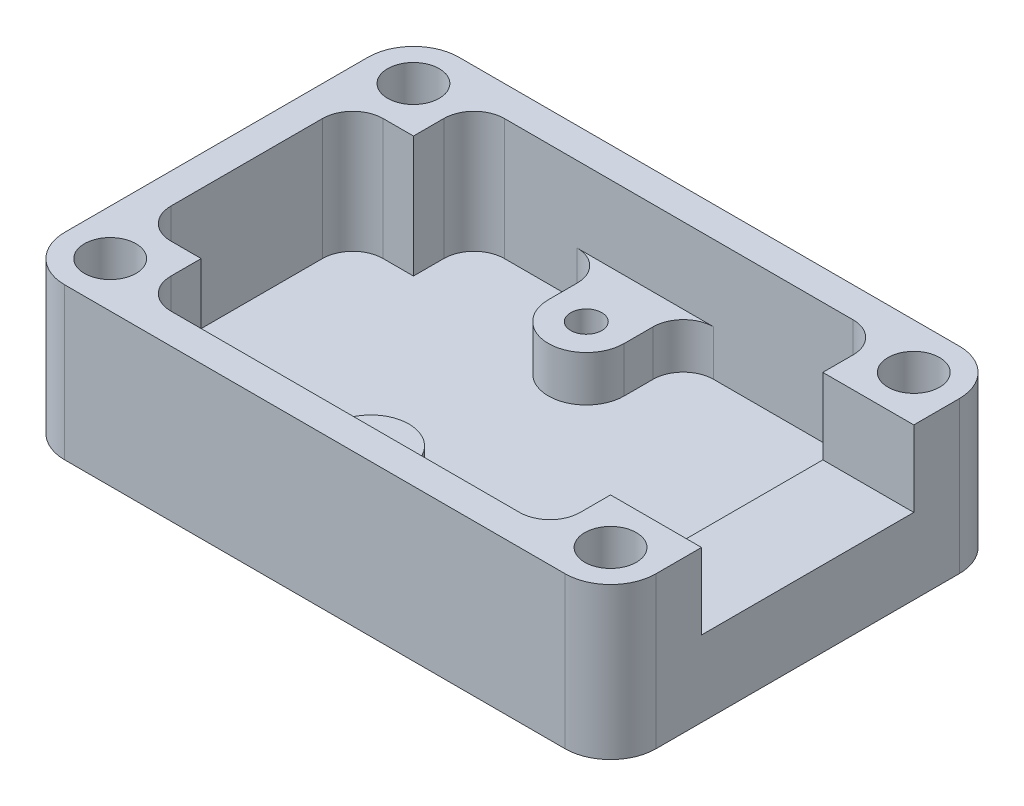
from build123d import *

# Parameters (mm, degrees)
SKETCH_1_W          = 39
SKETCH_1_H          = 26
EXTRUDE_1_DEPTH     = 10
SKETCH_2_W          = 35
SKETCH_2_H          = 22
CUT_EXTRUDE_1_DEPTH = 8
EXTRUDE_2_DEPTH     = 3
M2_5X0_451_D        = 2.05
M2_5X0_451_DEPTH    = 4
M2_5X0_451_TIP      = 0.615882135
SKETCH_6_W          = 6
SKETCH_6_H          = 6
EXTRUDE_3_DEPTH     = 8
HOLE_WIZARD_M32_D   = 3.4
CUT_EXTRUDE_2_REACH = 49.927
SKETCH_14_W         = 14
SKETCH_14_H         = 5
SKETCH_15_W         = 14
SKETCH_15_H         = 3
EXTRUDE_4_DEPTH     = 4
FILLET_1_R          = 2
FILLET_2_R          = 3


with BuildPart() as part:
    # Эскиз1 → Бобышка-Вытянуть1 (new body)
    with BuildSketch(Plane(origin=(0, 0, 0), x_dir=(1, 0, 0), z_dir=(0, 1, 0))):
        with Locations((19.5, 13)):
            Rectangle(SKETCH_1_W, SKETCH_1_H)
    extrude(amount=EXTRUDE_1_DEPTH)

    # Эскиз2 → Вырез-Вытянуть1 (cut)
    with BuildSketch(Plane(origin=(0, 10, 0), x_dir=(1, 0, 0), z_dir=(0, 1, 0))):
        with Locations((19.5, 13)):
            Rectangle(SKETCH_2_W, SKETCH_2_H)
    extrude(amount=-CUT_EXTRUDE_1_DEPTH, mode=Mode.SUBTRACT)

    # Эскиз3 → Бобышка-Вытянуть2 (add)
    with BuildSketch(Plane(origin=(0, 2, 0), x_dir=(1, 0, 0), z_dir=(0, 1, 0))):
        with BuildLine():
            Line((14.8, 20.1), (14.8, 24))
            Line((14.8, 24), (19.8, 24))
            Line((19.8, 24), (19.8, 20.1))
            ThreePointArc((19.8, 20.1), (17.3, 17.6), (14.8, 20.1))
        make_face()
        with BuildLine():
            Line((19.8, 2), (19.8, 5.9))
            ThreePointArc((19.8, 5.9), (17.3, 8.4), (14.8, 5.9))
            Line((14.8, 5.9), (14.8, 2))
            Line((14.8, 2), (19.8, 2))
        make_face()
    extrude(amount=EXTRUDE_2_DEPTH)

    # Отверстие обработанное метчиком M2.5x0.451
    with Locations(Plane(origin=(0, 5, 0), x_dir=(1, 0, 0), z_dir=(0, 1, 0))):
        with Locations((17.3, 20.1), (17.3, 5.9)):
            Hole(M2_5X0_451_D / 2, depth=M2_5X0_451_DEPTH)
            with Locations((0, 0, -(M2_5X0_451_DEPTH + M2_5X0_451_TIP / 2))):  # 118° drill point
                Cone(0, M2_5X0_451_D / 2, M2_5X0_451_TIP, mode=Mode.SUBTRACT)

    # Эскиз6 → Бобышка-Вытянуть3 (add, through all)
    with BuildSketch(Plane(origin=(0, 2, 0), x_dir=(1, 0, 0), z_dir=(0, 1, 0))):
        with Locations((3, 3)):
            Rectangle(SKETCH_6_W, SKETCH_6_H)
        with Locations((36, 23)):
            Rectangle(SKETCH_6_W, SKETCH_6_H)
        with Locations((36, 3)):
            Rectangle(SKETCH_6_W, SKETCH_6_H)
        with Locations((3, 23)):
            Rectangle(SKETCH_6_W, SKETCH_6_H)
    extrude(amount=EXTRUDE_3_DEPTH)

    # Отверстие с зазором M32 (through all)
    with Locations(Plane(origin=(0, 10, 0), x_dir=(1, 0, 0), z_dir=(0, 1, 0))):
        with Locations((3, 23), (36, 23), (36, 3), (3, 3)):
            Hole(HOLE_WIZARD_M32_D / 2)

    # Эскиз14 → Вырез-Вытянуть2 (cut, up to next)
    with BuildSketch(Plane(origin=(39, 0, 0), x_dir=(0, 0, -1), z_dir=(1, 0, 0)), mode=Mode.PRIVATE) as cut_extrude_2_sk1:
        with Locations((13, 7.5)):
            Rectangle(SKETCH_14_W, SKETCH_14_H)
    cut_extrude_2_tool1 = extrude(cut_extrude_2_sk1.sketch, amount=-CUT_EXTRUDE_2_REACH, mode=Mode.PRIVATE) & part.part
    add(cut_extrude_2_tool1.solids().sort_by_distance((39, 7.5, -13))[0], mode=Mode.SUBTRACT)

    # Эскиз15 → Бобышка-Вытянуть4 (add)
    with BuildSketch(Plane.ZY.offset(-37)):
        with Locations((-13, 3.5)):
            Rectangle(SKETCH_15_W, SKETCH_15_H)
    extrude(amount=EXTRUDE_4_DEPTH)

    # Скругление1
    fillet_1_edges = [part.edges().sort_by_distance(p)[0] for p in [
        (33, 6, -2),
        (2, 6, -20),
        (6, 6, -24),
        (19.8, 3.5, -24),
        (14.8, 3.5, -24),
        (14.8, 3.5, -2),
        (19.8, 3.5, -2),
        (2, 6, -6),
        (6, 6, -2),
        (33, 6, -24),
    ]]
    fillet(fillet_1_edges, radius=FILLET_1_R)

    # Скругление2
    fillet_2_edges = [part.edges().sort_by_distance(p)[0] for p in [
        (0, 5, -26),
        (39, 5, -26),
        (39, 5, 0),
        (0, 5, 0),
    ]]
    fillet(fillet_2_edges, radius=FILLET_2_R)


solid = part.part
